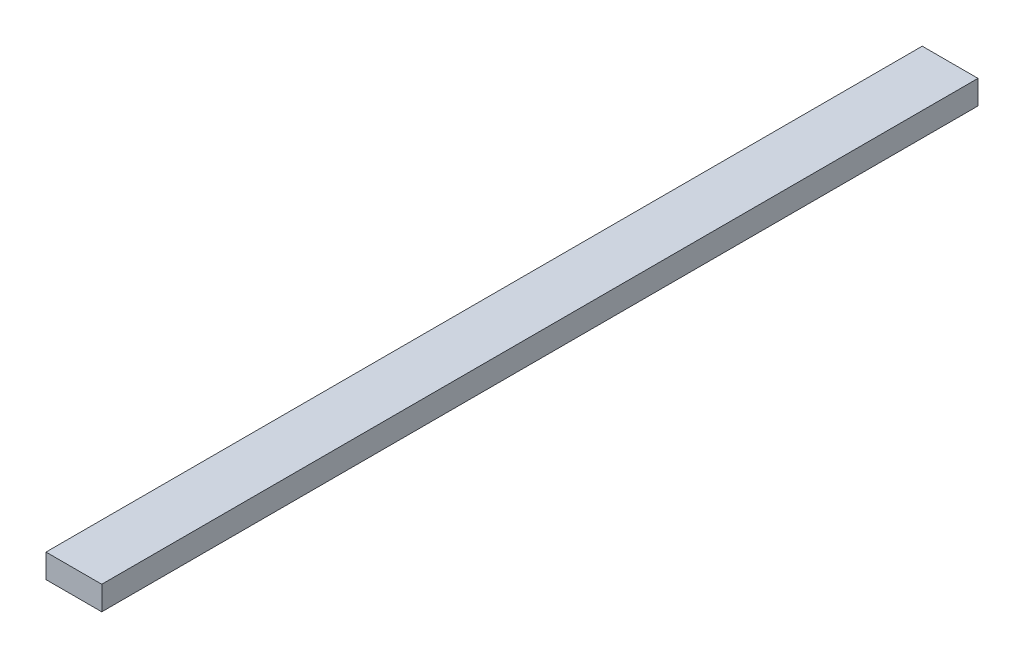
from build123d import *

# Parameters (mm, degrees)
SKETCH1_W           = 88.9
SKETCH1_H           = 38.1
BOSS_EXTRUDE1_DEPTH = 698.5


with BuildPart() as part:
    # Sketch1 → Boss-Extrude1 (new, symmetric)
    with BuildSketch(Plane.XY):
        Rectangle(SKETCH1_W, SKETCH1_H)
    extrude(amount=BOSS_EXTRUDE1_DEPTH, both=True)


solid = part.part
